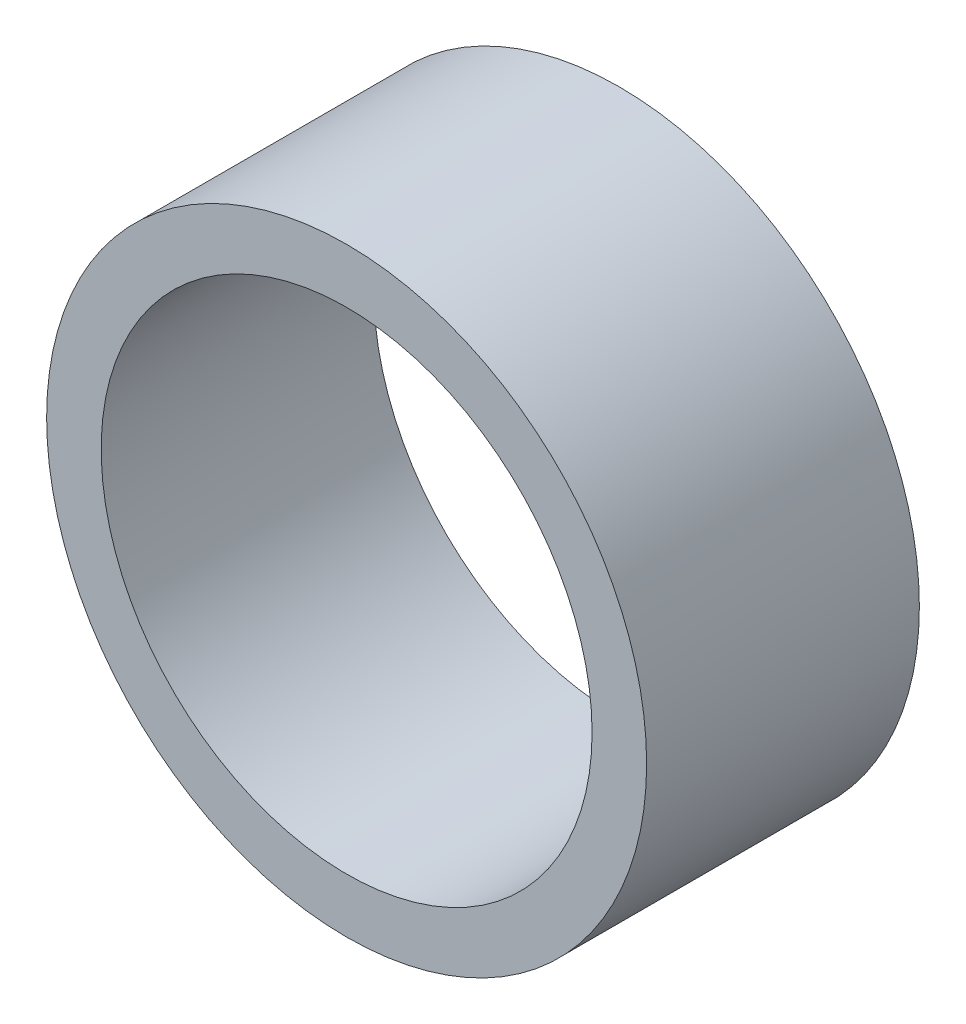
from build123d import *

# Parameters (mm, degrees)
SKETCH_1_R      = 5.5
SKETCH_1_R_2    = 4.5
EXTRUDE_1_DEPTH = 5


with BuildPart() as part:
    # 草图1 → 凸台-拉伸1 (new body)
    with BuildSketch(Plane.XY):
        Circle(SKETCH_1_R)
        Circle(SKETCH_1_R_2, mode=Mode.SUBTRACT)
    extrude(amount=EXTRUDE_1_DEPTH)


solid = part.part
